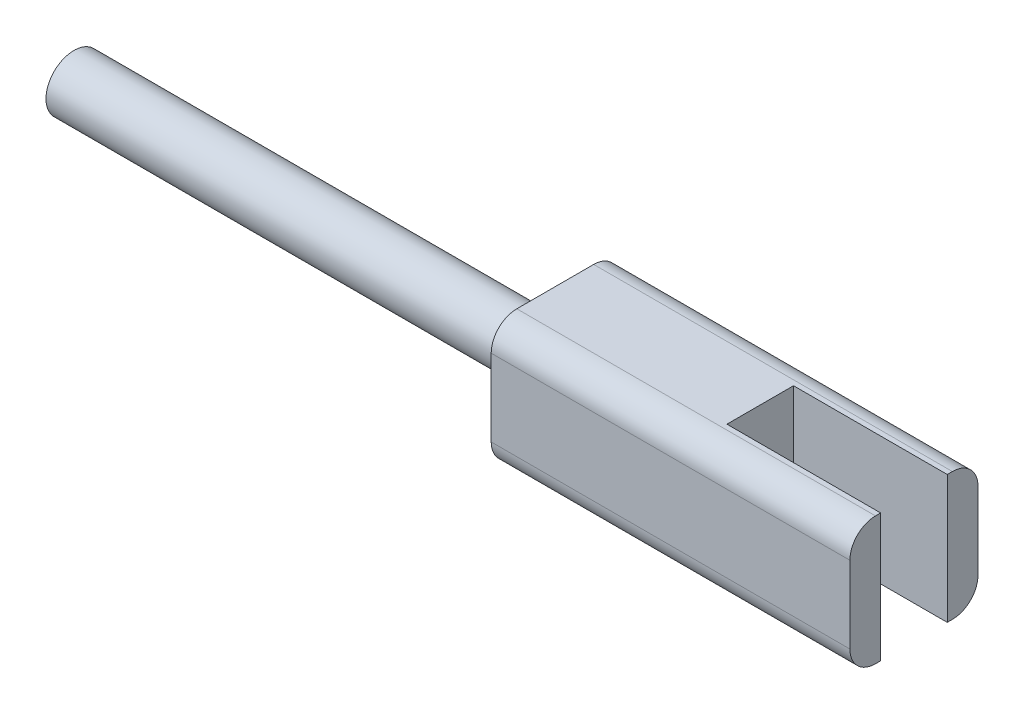
from build123d import *

# Parameters (mm, degrees)
SKETCH1_R               = 1.09
BOSS_EXTRUDE1_DEPTH     = 20.786
BOSS_EXTRUDE2_DEPTH     = 14
CUT_EXTRUDE1_DEPTH      = 33.976079148
CUT_EXTRUDE1_DEPTH_BACK = 33.976079148
SKETCH3_W               = 7
SKETCH3_H               = 2.6


with BuildPart() as part:
    # Sketch1 → Boss-Extrude1 (new body)
    with BuildSketch(Plane(origin=(0, 0, 0), x_dir=(0, 0, -1), z_dir=(1, 0, 0))):
        with Locations(Location((0, 0, 0), (0, 0, 180))):
            Circle(SKETCH1_R)
    extrude(amount=BOSS_EXTRUDE1_DEPTH)

    # Sketch2 → Boss-Extrude2 (add)
    with BuildSketch(Plane(origin=(18.786, 0, 0), x_dir=(0, 0, -1), z_dir=(1, 0, 0))):
        with BuildLine():
            Line((-1.5, -2.5), (1.5, -2.5))
            ThreePointArc((1.5, -2.5), (2.207106781, -2.207106781), (2.5, -1.5))
            Line((2.5, -1.5), (2.5, 1.5))
            ThreePointArc((2.5, 1.5), (2.207106781, 2.207106781), (1.5, 2.5))
            Line((1.5, 2.5), (-1.5, 2.5))
            ThreePointArc((-1.5, 2.5), (-2.207106781, 2.207106781), (-2.5, 1.5))
            Line((-2.5, 1.5), (-2.5, -1.5))
            ThreePointArc((-2.5, -1.5), (-2.207106781, -2.207106781), (-1.5, -2.5))
        make_face()
    extrude(amount=BOSS_EXTRUDE2_DEPTH)

    # Sketch3 → Cut-Extrude1 (cut, two sides: drawn at the far end of the back side and taken through both)
    with BuildSketch(Plane(origin=(0, 0, 0), x_dir=(1, 0, 0), z_dir=(0, 1, 0)).offset(-CUT_EXTRUDE1_DEPTH_BACK)):
        with Locations((30.286, 0)):
            Rectangle(SKETCH3_W, SKETCH3_H)
    extrude(amount=CUT_EXTRUDE1_DEPTH + CUT_EXTRUDE1_DEPTH_BACK, mode=Mode.SUBTRACT)


solid = part.part
